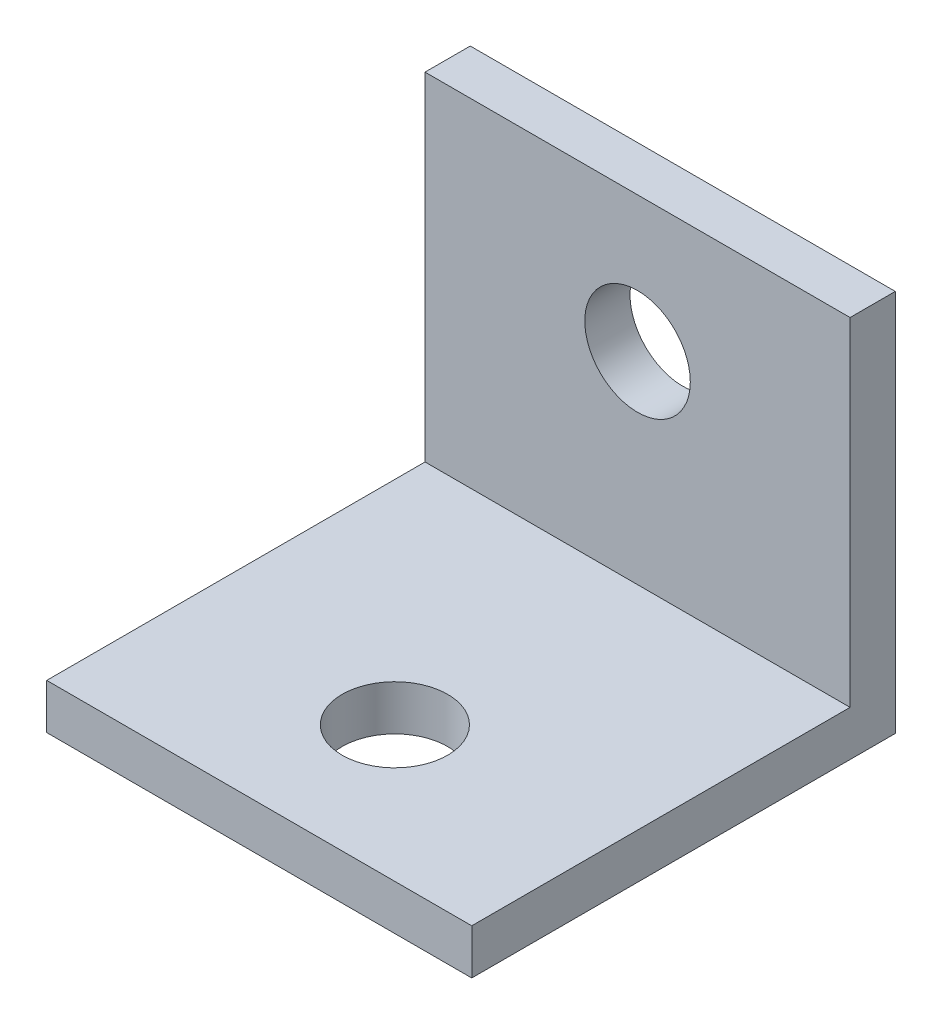
from build123d import *

# Parameters (mm, degrees)
ESBO_O1_W                = 28.2
ESBO_O1_H                = 25.4
RESSALTO_EXTRUS_O1_DEPTH = 3
ESBO_O2_W                = 28.2
ESBO_O2_H                = 3
RESSALTO_EXTRUS_O2_DEPTH = 25.1
ESBO_O3_R                = 3.5
CORTE_EXTRUS_O1_DEPTH    = 3
ESBO_O4_R                = 3.5
CORTE_EXTRUS_O2_DEPTH    = 3


with BuildPart() as part:
    # Esboço1 → Ressalto-extrusão1 (new body)
    with BuildSketch(Plane.XY):
        with Locations((-14.1, 3.482258065)):
            Rectangle(ESBO_O1_W, ESBO_O1_H)
    extrude(amount=RESSALTO_EXTRUS_O1_DEPTH)

    # Esboço2 → Ressalto-extrusão2 (add)
    with BuildSketch(Plane.XY.offset(3)):
        with Locations((-14.1, -7.717741935)):
            Rectangle(ESBO_O2_W, ESBO_O2_H)
    extrude(amount=RESSALTO_EXTRUS_O2_DEPTH)

    # Esboço3 → Corte-extrusão1 (cut)
    with BuildSketch(Plane(origin=(0, -6.217741935, 0), x_dir=(1, 0, 0), z_dir=(0, 1, 0))):
        with Locations(Location((-14.1, -19.1, 0), (0, 0, 270))):
            Circle(ESBO_O3_R)
    extrude(amount=-CORTE_EXTRUS_O1_DEPTH, mode=Mode.SUBTRACT)

    # Esboço4 → Corte-extrusão2 (cut)
    with BuildSketch(Plane.XY.offset(3)):
        with Locations((-14.1, 7.182258065)):
            Circle(ESBO_O4_R)
    extrude(amount=-CORTE_EXTRUS_O2_DEPTH, mode=Mode.SUBTRACT)


solid = part.part
